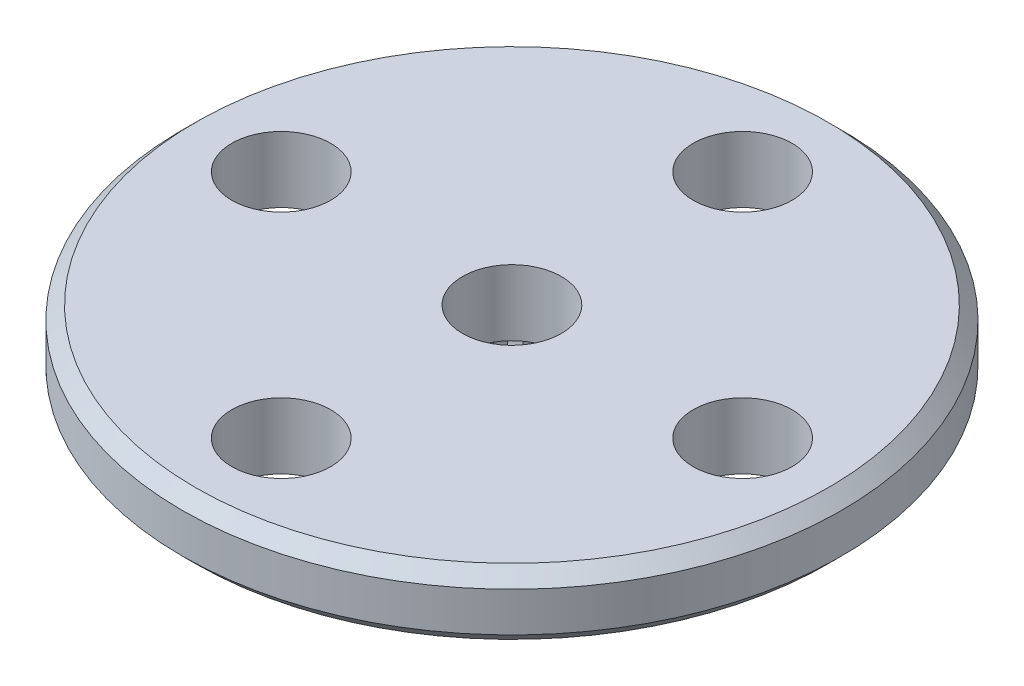
from build123d import *

# Parameters (mm, degrees)
SKETCH_1_R          = 10
SKETCH_1_R_2        = 1.5
EXTRUDE_2_DEPTH     = 2
SKETCH_2_R          = 4.5
EXTRUDE_3_DEPTH     = 2.9
CHAMFER_1_SIZE      = 0.4
SKETCH_5_R          = 1.5
CUT_EXTRUDE_1_DEPTH = 10


with BuildPart() as part:
    # 草图1 → 凸台-拉伸2 (new body)
    with BuildSketch(Plane(origin=(0, 0, 0), x_dir=(1, 0, 0), z_dir=(0, 1, 0))):
        with Locations(Location((0, 0, 0), (0, 0, 270))):
            Circle(SKETCH_1_R)
        with Locations(Location((0, 7, 0), (0, 0, 270))):
            Circle(SKETCH_1_R_2, mode=Mode.SUBTRACT)
        with Locations(Location((7, 0, 0), (0, 0, 270))):
            Circle(SKETCH_1_R_2, mode=Mode.SUBTRACT)
        with Locations(Location((-7, 0, 0), (0, 0, 270))):
            Circle(SKETCH_1_R_2, mode=Mode.SUBTRACT)
        with Locations(Location((0, -7, 0), (0, 0, 270))):
            Circle(SKETCH_1_R_2, mode=Mode.SUBTRACT)
    extrude(amount=EXTRUDE_2_DEPTH)

    # 草图2 → 凸台-拉伸3 (add)
    with BuildSketch(Plane(origin=(0, 0, 0), x_dir=(1, 0, 0), z_dir=(0, 1, 0))):
        with Locations(Location((0, 0, 0), (0, 0, 270))):
            Circle(SKETCH_2_R)
        Polygon((2.5, 0), (2.976344104, 0.375999701), (2.421457903, 0.621724718), (2.789329458, 1.104373658), (2.1907667, 1.204384185), (2.427050983, 1.763355757), (1.822421569, 1.711367765), (1.912271969, 2.311539728), (1.339566987, 2.110819814), (1.277337875, 2.714481157), (0.772542486, 2.377641291), (0.562143944, 2.946861752), (0.156976299, 2.495066821), (-0.188371559, 2.994080185), (-0.468453286, 2.455718127), (-0.927050983, 2.853169549), (-1.064448229, 2.262067631), (-1.607480385, 2.532983777), (-1.593559974, 1.926283107), (-2.186905882, 2.053641318), (-2.022542486, 1.469463131), (-2.62892004, 1.445261022), (-2.324441215, 0.920311382), (-2.905749483, 0.746069661), (-2.480286753, 0.313333084), (-3, 0), (-2.480286753, -0.313333084), (-2.905749483, -0.746069661), (-2.324441215, -0.920311382), (-2.62892004, -1.445261022), (-2.022542486, -1.469463131), (-2.186905882, -2.053641318), (-1.593559974, -1.926283107), (-1.607480385, -2.532983777), (-1.064448229, -2.262067631), (-0.927050983, -2.853169549), (-0.468453286, -2.455718127), (-0.188371559, -2.994080185), (0.156976299, -2.495066821), (0.562143944, -2.946861752), (0.772542486, -2.377641291), (1.277337875, -2.714481157), (1.339566987, -2.110819814), (1.912271969, -2.311539728), (1.822421569, -1.711367765), (2.427050983, -1.763355757), (2.1907667, -1.204384185), (2.789329458, -1.104373658), (2.421457903, -0.621724718), (2.976344104, -0.375999701), align=None, mode=Mode.SUBTRACT)
    extrude(amount=-EXTRUDE_3_DEPTH)

    # 草图4 → 切除-旋转1 (revolve, cut)
    with BuildSketch(Plane.XY):
        Polygon((0, -2.9), (0, -2.128896783), (2.5, -2.128896783), (3.136710161, -2.9), align=None)
    revolve(axis=Axis((0, -2.9, 0), (0, 1, 0)), mode=Mode.SUBTRACT)

    # 倒角1
    chamfer_1_edges = [part.edges().sort_by_distance(p)[0] for p in [
        (0, 0, -10),
        (0, 2, -10),
    ]]
    chamfer(chamfer_1_edges, length=CHAMFER_1_SIZE)

    # 草图5 → 切除-拉伸1 (cut)
    with BuildSketch(Plane(origin=(0, 0, 0), x_dir=(1, 0, 0), z_dir=(0, 1, 0))):
        with Locations(Location((0, 0, 0), (0, 0, 270))):
            Circle(SKETCH_5_R)
    extrude(amount=CUT_EXTRUDE_1_DEPTH, mode=Mode.SUBTRACT)


solid = part.part
